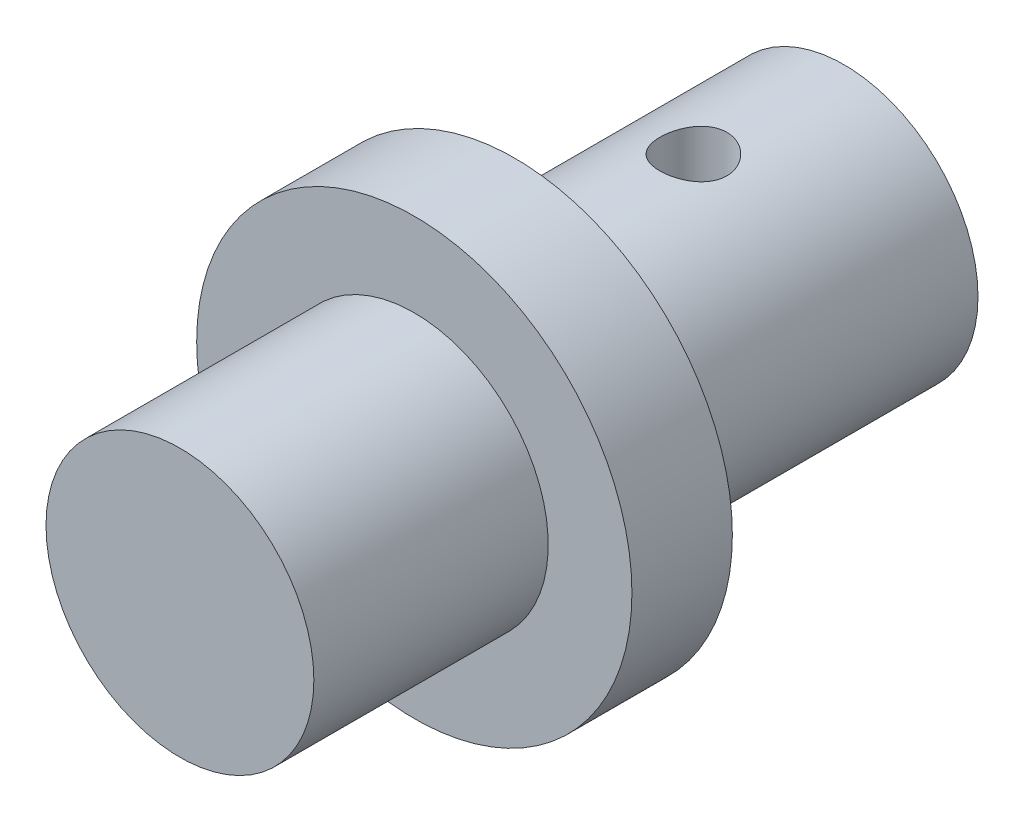
from build123d import *

# Parameters (mm, degrees)
SKETCH1_R           = 4
BOSS_EXTRUDE1_DEPTH = 19.83582727
SKETCH3_R           = 1
CUT_EXTRUDE1_DEPTH  = 22.759137012
SKETCH4_R           = 2.475
CUT_EXTRUDE2_DEPTH  = 2.58519454
BOSS_EXTRUDE2_START = 3
SKETCH5_R           = 6.5
SKETCH5_R_2         = 4
BOSS_EXTRUDE2_DEPTH = 3


with BuildPart() as part:
    # Sketch1 → Boss-Extrude1 (new body)
    with BuildSketch(Plane.XY):
        Circle(SKETCH1_R)
    extrude(amount=BOSS_EXTRUDE1_DEPTH)

    # Sketch3 → Cut-Extrude1 (cut, through all)
    with BuildSketch(Plane(origin=(0, -4, 0), x_dir=(-1, 0, 0), z_dir=(0, -1, 0))):
        with Locations(Location((0, -4.5, 0), (0, 0, 90))):
            Circle(SKETCH3_R)
    extrude(amount=-CUT_EXTRUDE1_DEPTH, mode=Mode.SUBTRACT)

    # Sketch4 → Cut-Extrude2 (cut)
    with BuildSketch(Plane(origin=(0, -4, 0), x_dir=(-1, 0, 0), z_dir=(0, -1, 0))):
        with Locations(Location((0, -4.5, 0), (0, 0, 90))):
            Circle(SKETCH4_R)
    extrude(amount=-CUT_EXTRUDE2_DEPTH, mode=Mode.SUBTRACT)

    # Sketch5 → Boss-Extrude2 (add)
    with BuildSketch(Plane(origin=(0, 0, 12.8359246), x_dir=(-1, 0, 0), z_dir=(0, 0, -1)).offset(BOSS_EXTRUDE2_START)):
        Circle(SKETCH5_R)
        Circle(SKETCH5_R_2, mode=Mode.SUBTRACT)
    extrude(amount=-BOSS_EXTRUDE2_DEPTH)


solid = part.part
